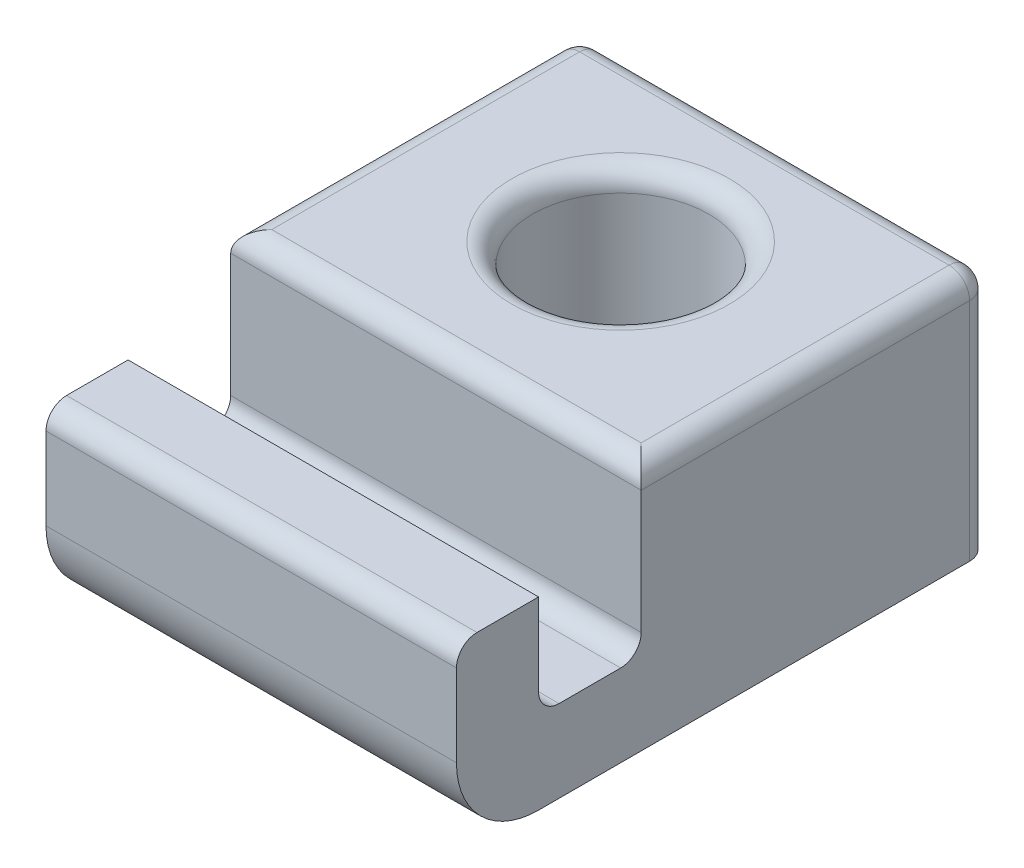
from build123d import *

# Parameters (mm, degrees)
SKETCH1_W           = 10
SKETCH1_H           = 13
BOSS_EXTRUDE1_DEPTH = 2
SKETCH2_W           = 10
SKETCH2_H           = 2
BOSS_EXTRUDE2_DEPTH = 2.5
FILLET1_R           = 2
FILLET2_R           = 0.5
SKETCH3_W           = 10
SKETCH3_H           = 8.5
BOSS_EXTRUDE3_DEPTH = 4
CUT_EXTRUDE1_REACH  = 12.161
SKETCH4_R           = 2.15
FILLET3_R           = 0.5
FILLET4_R           = 0.5


with BuildPart() as part:
    # Sketch1 → Boss-Extrude1 (new body)
    with BuildSketch(Plane(origin=(0, 0, 0), x_dir=(1, 0, 0), z_dir=(0, 1, 0))):
        Rectangle(SKETCH1_W, SKETCH1_H)
    extrude(amount=BOSS_EXTRUDE1_DEPTH)

    # Sketch2 → Boss-Extrude2 (add)
    with BuildSketch(Plane(origin=(0, 2, 0), x_dir=(1, 0, 0), z_dir=(0, 1, 0))):
        with Locations((0, -5.5)):
            Rectangle(SKETCH2_W, SKETCH2_H)
    extrude(amount=BOSS_EXTRUDE2_DEPTH)

    # Fillet1
    fillet1_edges = [part.edges().sort_by_distance(p)[0] for p in [
        (0, 0, 6.5),
    ]]
    fillet(fillet1_edges, radius=FILLET1_R)

    # Fillet2
    fillet2_edges = [part.edges().sort_by_distance(p)[0] for p in [
        (0, 4.5, 6.5),
    ]]
    fillet(fillet2_edges, radius=FILLET2_R)

    # Sketch3 → Boss-Extrude3 (add)
    with BuildSketch(Plane(origin=(0, 2, 0), x_dir=(1, 0, 0), z_dir=(0, 1, 0))):
        with Locations((0, 2.25)):
            Rectangle(SKETCH3_W, SKETCH3_H)
    extrude(amount=BOSS_EXTRUDE3_DEPTH)

    # Sketch4 → Cut-Extrude1 (cut, up to next)
    with BuildSketch(Plane(origin=(0, 6, 0), x_dir=(1, 0, 0), z_dir=(0, 1, 0)), mode=Mode.PRIVATE) as cut_extrude1_sk1:
        with Locations(Location((0, 2.5, 0), (0, 0, 270))):
            Circle(SKETCH4_R)
    cut_extrude1_tool1 = extrude(cut_extrude1_sk1.sketch, amount=-CUT_EXTRUDE1_REACH, mode=Mode.PRIVATE) & part.part
    add(cut_extrude1_tool1.solids().sort_by_distance((0, 6, -2.5))[0], mode=Mode.SUBTRACT)

    # Fillet3
    fillet3_edges = [part.edges().sort_by_distance(p)[0] for p in [
        (0, 2, 4.5),
        (0, 2, 2),
        (-5, 6, -2.25),
        (0, 6, 2),
        (5, 6, -2.25),
        (0, 6, -6.5),
        (-5, 3, -6.5),
        (5, 3, -6.5),
    ]]
    fillet(fillet3_edges, radius=FILLET3_R)

    # Fillet4
    fillet4_edges = [part.edges().sort_by_distance(p)[0] for p in [
        (0, 6, -4.65),
    ]]
    fillet(fillet4_edges, radius=FILLET4_R)


solid = part.part
